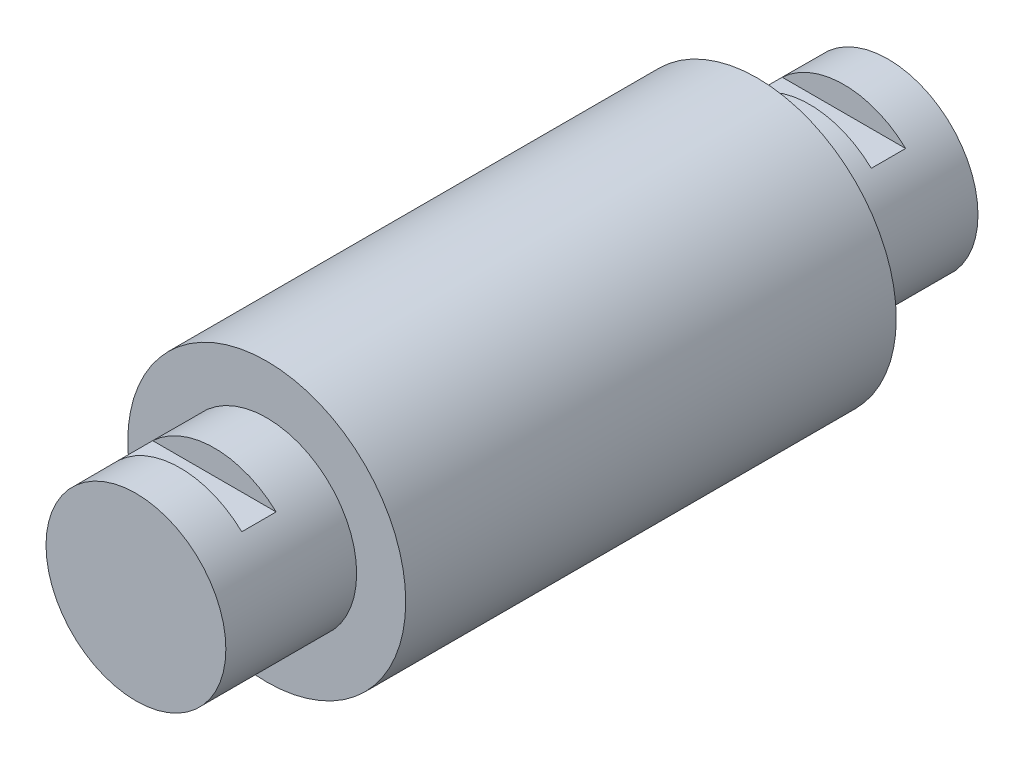
from build123d import *

# Parameters (mm, degrees)
SKETCH2_R           = 42.5
BOSS_EXTRUDE2_DEPTH = 75
SKETCH3_R           = 27.5
BOSS_EXTRUDE3_DEPTH = 40
SKETCH4_W           = 10.5
SKETCH4_H           = 8.79879656
CUT_EXTRUDE1_DEPTH  = 50


with BuildPart() as part:
    # Sketch2 → Boss-Extrude2 (new, symmetric)
    with BuildSketch(Plane.XY):
        Circle(SKETCH2_R)
    extrude(amount=BOSS_EXTRUDE2_DEPTH, both=True)

    # Sketch3 → Boss-Extrude3 (add)
    with BuildSketch(Plane.XY.offset(75)):
        Circle(SKETCH3_R)
    boss_extrude3 = extrude(amount=BOSS_EXTRUDE3_DEPTH)

    # Sketch4 → Cut-Extrude1 (cut, symmetric)
    with BuildSketch(Plane(origin=(0, 0, 0), x_dir=(0, 0, -1), z_dir=(1, 0, 0))):
        with Locations((-96.25, 24.39939828)):
            Rectangle(SKETCH4_W, SKETCH4_H)
    cut_extrude1 = extrude(amount=CUT_EXTRUDE1_DEPTH, both=True, mode=Mode.SUBTRACT)

    # Mirror3: Boss-Extrude3, Cut-Extrude1 across plane
    add(boss_extrude3.mirror(Plane.XY))
    add(cut_extrude1.mirror(Plane.XY), mode=Mode.SUBTRACT)


solid = part.part
